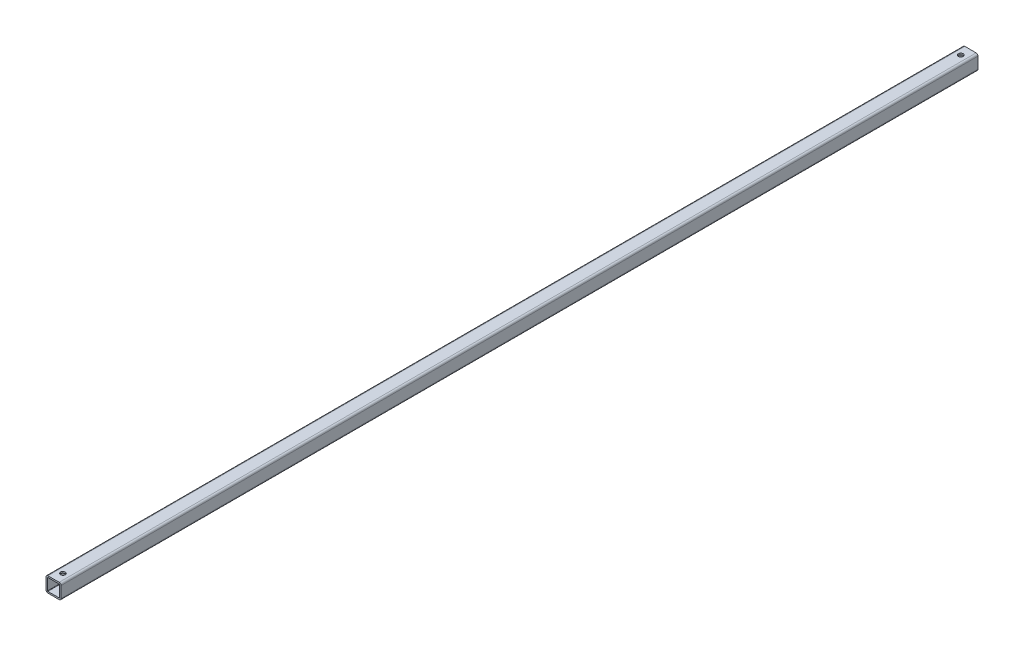
from build123d import *

# Parameters (mm, degrees)
EXTRUDE_THIN1_DEPTH             = 609.6
F_1_4_0_25_DIAMETER_HOLE1_D     = 6.35
F_1_4_0_25_DIAMETER_HOLE1_DEPTH = 25.4
F_1_4_0_25_DIAMETER_HOLE1_TIP   = 1.907732465


with BuildPart() as part:
    # Sketch1 → Extrude-Thin1 (new, symmetric)
    with BuildSketch(Plane.XY):
        with BuildLine():
            Line((-10, -7.5), (-10, 7.5))
            ThreePointArc((-10, 7.5), (-9.267766953, 9.267766953), (-7.5, 10))
            Line((-7.5, 10), (7.5, 10))
            ThreePointArc((7.5, 10), (9.267766953, 9.267766953), (10, 7.5))
            Line((10, 7.5), (10, -7.5))
            ThreePointArc((10, -7.5), (9.267766953, -9.267766953), (7.5, -10))
            Line((7.5, -10), (-7.5, -10))
            ThreePointArc((-7.5, -10), (-9.267766953, -9.267766953), (-10, -7.5))
        make_face()
        with BuildLine():
            Line((-8, -7.5), (-8, 7.5))
            ThreePointArc((-8, 7.5), (-7.853553391, 7.853553391), (-7.5, 8))
            Line((-7.5, 8), (7.5, 8))
            ThreePointArc((7.5, 8), (7.853553391, 7.853553391), (8, 7.5))
            Line((8, 7.5), (8, -7.5))
            ThreePointArc((8, -7.5), (7.853553391, -7.853553391), (7.5, -8))
            Line((7.5, -8), (-7.5, -8))
            ThreePointArc((-7.5, -8), (-7.853553391, -7.853553391), (-8, -7.5))
        make_face(mode=Mode.SUBTRACT)
    extrude(amount=EXTRUDE_THIN1_DEPTH, both=True)

    # 1/4 (0.25) Diameter Hole1
    with Locations(Plane(origin=(0, 10, 0), x_dir=(1, 0, 0), z_dir=(0, 1, 0))):
        with Locations((-0.2, 596.9), (-0.2, -596.9)):
            Hole(F_1_4_0_25_DIAMETER_HOLE1_D / 2, depth=F_1_4_0_25_DIAMETER_HOLE1_DEPTH)
            with Locations((0, 0, -(F_1_4_0_25_DIAMETER_HOLE1_DEPTH + F_1_4_0_25_DIAMETER_HOLE1_TIP / 2))):  # 118° drill point
                Cone(0, F_1_4_0_25_DIAMETER_HOLE1_D / 2, F_1_4_0_25_DIAMETER_HOLE1_TIP, mode=Mode.SUBTRACT)


solid = part.part
